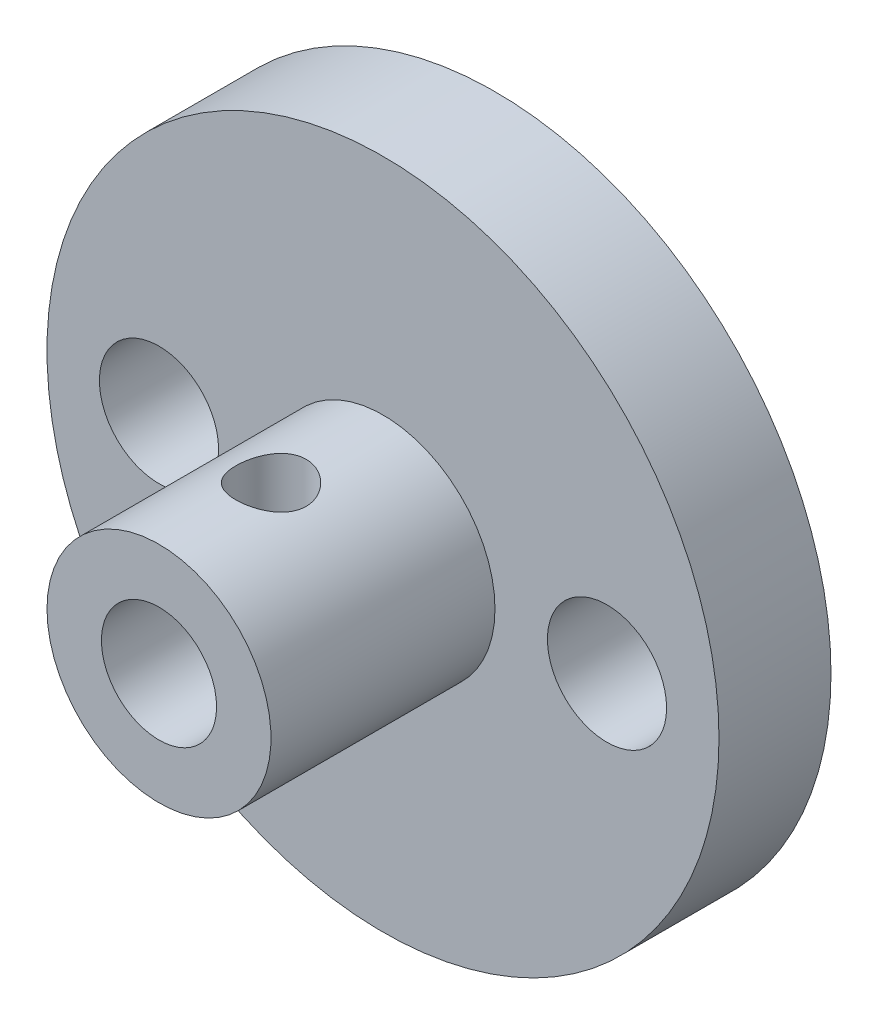
from build123d import *

# Parameters (mm, degrees)
SKETCH1_R                  = 19.05
BOSS_EXTRUDE1_DEPTH        = 6.35
SKETCH2_R                  = 6.35
BOSS_EXTRUDE2_DEPTH        = 19.05
F_0_257_DIAMETER_HOLE1_D   = 6.5278
F_10_24_TAPPED_HOLE3_D     = 3.9878
F_10_24_TAPPED_HOLE3_DEPTH = 6.349
F_10_24_TAPPED_HOLE3_TIP   = 1.198055988
H_0_266_DIAMETER_HOLE1_D   = 6.7564


with BuildPart() as part:
    # Sketch1 → Boss-Extrude1 (new body)
    with BuildSketch(Plane.XY):
        Circle(SKETCH1_R)
    extrude(amount=BOSS_EXTRUDE1_DEPTH)

    # Sketch2 → Boss-Extrude2 (add)
    with BuildSketch(Plane(origin=(0, 0, 0), x_dir=(-1, 0, 0), z_dir=(0, 0, -1))):
        Circle(SKETCH2_R)
    extrude(amount=-BOSS_EXTRUDE2_DEPTH)

    # F (0.257) Diameter Hole1 (through all)
    with Locations(Plane.XY.offset(19.05)):
        with Locations((0, 0)):
            Hole(F_0_257_DIAMETER_HOLE1_D / 2)

    # #10-24 Tapped Hole3
    with Locations(Plane(origin=(0, 6.35, 12.7), x_dir=(0, 0, 1), z_dir=(0, 1, 0))):
        with Locations((0, 0)):
            Hole(F_10_24_TAPPED_HOLE3_D / 2, depth=F_10_24_TAPPED_HOLE3_DEPTH)
            with Locations((0, 0, -(F_10_24_TAPPED_HOLE3_DEPTH + F_10_24_TAPPED_HOLE3_TIP / 2))):  # 118° drill point
                Cone(0, F_10_24_TAPPED_HOLE3_D / 2, F_10_24_TAPPED_HOLE3_TIP, mode=Mode.SUBTRACT)

    # H (0.266) Diameter Hole1 (through all)
    with Locations(Plane.XY.offset(6.35)):
        with Locations((-12.7, 0), (12.7, 0)):
            Hole(H_0_266_DIAMETER_HOLE1_D / 2)


solid = part.part
